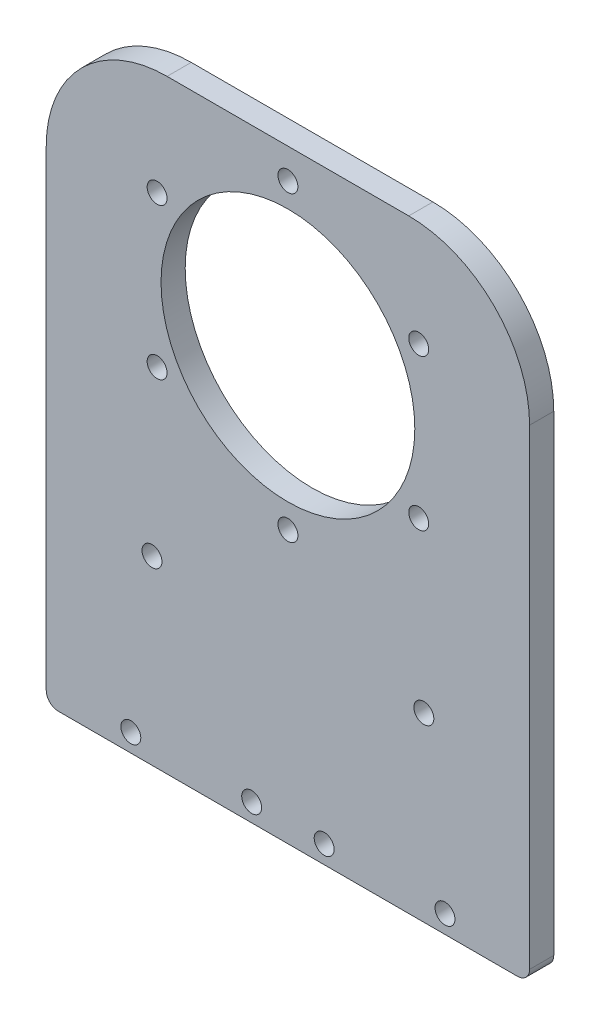
from build123d import *

# Parameters (mm, degrees)
SKETCH_1_W          = 80
SKETCH_1_H          = 100
SKETCH_1_R          = 1.65
EXTRUDE_1_DEPTH     = 4
SKETCH_3_R          = 21
CUT_EXTRUDE_2_DEPTH = 65.156059729
FILLET_1_R          = 2
SKETCH_2_R          = 1.65
CUT_EXTRUDE_1_DEPTH = 65.156059729
FILLET_2_R          = 20
SKETCH_4_R          = 1.65
CUT_EXTRUDE_3_DEPTH = 65.156059729


with BuildPart() as part:
    # 草图1 → 凸台-拉伸1 (new body)
    with BuildSketch(Plane.XY):
        Rectangle(SKETCH_1_W, SKETCH_1_H)
        with Locations((0, 45)):
            Circle(SKETCH_1_R, mode=Mode.SUBTRACT)
        with Locations((21.650635095, 32.5)):
            Circle(SKETCH_1_R, mode=Mode.SUBTRACT)
        with Locations((21.650635095, 7.5)):
            Circle(SKETCH_1_R, mode=Mode.SUBTRACT)
        with Locations((0, -5)):
            Circle(SKETCH_1_R, mode=Mode.SUBTRACT)
        with Locations((-21.650635095, 7.5)):
            Circle(SKETCH_1_R, mode=Mode.SUBTRACT)
        with Locations((-21.650635095, 32.5)):
            Circle(SKETCH_1_R, mode=Mode.SUBTRACT)
    extrude(amount=EXTRUDE_1_DEPTH)

    # 草图3 → 切除-拉伸2 (cut, through all)
    with BuildSketch(Plane.XY.offset(4)):
        with Locations((0, 20)):
            Circle(SKETCH_3_R)
    extrude(amount=-CUT_EXTRUDE_2_DEPTH, mode=Mode.SUBTRACT)

    # 圆角1
    fillet_1_edges = [part.edges().sort_by_distance(p)[0] for p in [
        (40, -50, 2),
        (-40, -50, 2),
    ]]
    fillet(fillet_1_edges, radius=FILLET_1_R)

    # 草图2 → 切除-拉伸1 (cut, through all)
    with BuildSketch(Plane.XY.offset(4)):
        with Locations((-26, -47)):
            Circle(SKETCH_2_R)
        with Locations(Location((-6, -47, 0), (0, 0, 180))):
            Circle(SKETCH_2_R)
        with Locations((6, -47)):
            Circle(SKETCH_2_R)
        with Locations(Location((26, -47, 0), (0, 0, 180))):
            Circle(SKETCH_2_R)
    extrude(amount=-CUT_EXTRUDE_1_DEPTH, mode=Mode.SUBTRACT)

    # 圆角2
    fillet_2_edges = [part.edges().sort_by_distance(p)[0] for p in [
        (-40, 50, 2),
        (40, 50, 2),
    ]]
    fillet(fillet_2_edges, radius=FILLET_2_R)

    # 草图4 → 切除-拉伸3 (cut, through all)
    with BuildSketch(Plane.XY.offset(4)):
        with Locations((-22.5, -20)):
            Circle(SKETCH_4_R)
        with Locations((-22.5, 60)):
            Circle(SKETCH_4_R)
        with Locations(Location((22.5, -20, 0), (0, 0, 180))):
            Circle(SKETCH_4_R)
        with Locations((22.5, 60)):
            Circle(SKETCH_4_R)
    extrude(amount=-CUT_EXTRUDE_3_DEPTH, mode=Mode.SUBTRACT)


solid = part.part
